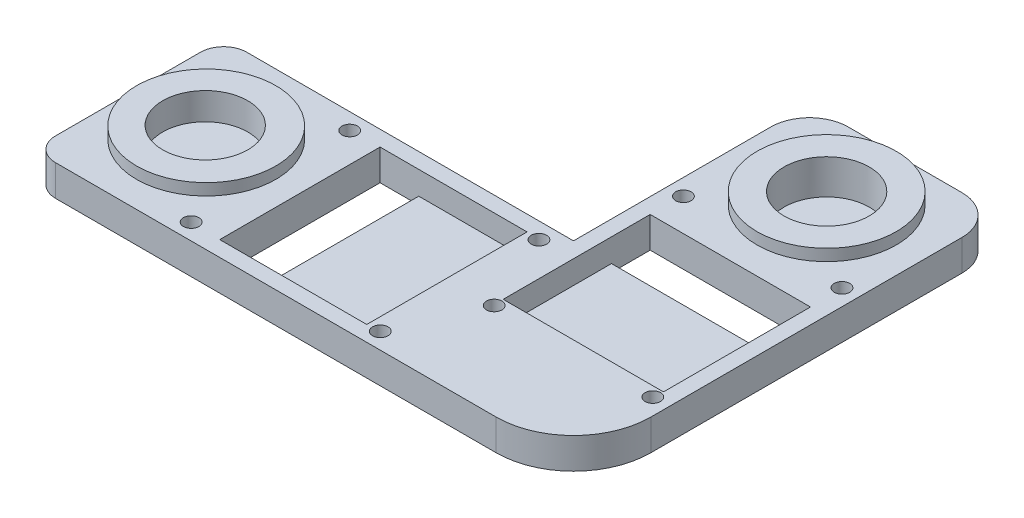
from build123d import *

# Parameters (mm, degrees)
EXTRUDE_1_DEPTH          = 4
CUT_EXTRUDE_1_DEPTH      = 38.905694823
CUT_EXTRUDE_1_DEPTH_BACK = 38.905694823
SKETCH_2_R               = 1
SKETCH_3_W               = 14
SKETCH_3_H               = 20.72
CUT_EXTRUDE_3_DEPTH      = 3
SKETCH_5_W               = 5
SKETCH_5_H               = 20.72
CUT_EXTRUDE_4_DEPTH      = 4
SKETCH_6_R               = 9
EXTRUDE_2_DEPTH          = 1.5
SKETCH_10_R              = 5.5
CUT_EXTRUDE_6_DEPTH      = 3.5
SKETCH_12_W              = 24.72
SKETCH_12_H              = 4
EXTRUDE_3_DEPTH          = 24.72
SKETCH_14_W              = 24.72
SKETCH_14_H              = 4
EXTRUDE_4_DEPTH          = 30.5
SKETCH_15_R              = 1
SKETCH_15_R_2            = 5.5
CUT_EXTRUDE_7_DEPTH      = 4
EXTRUDE_START            = 1.5
SKETCH_16_R              = 9
SKETCH_16_R_2            = 5.5
EXTRUDE_5_DEPTH          = 1.5
SKETCH_17_W              = 20.72
SKETCH_17_H              = 19
CUT_EXTRUDE_8_DEPTH      = 4
SKETCH_19_W              = 20.72
SKETCH_19_H              = 14
EXTRUDE_6_DEPTH          = 1
EXTRUDE_START_2          = -1
SKETCH_20_R              = 5.5
EXTRUDE_7_DEPTH          = 1
FILLET_1_R               = 5
FILLET_2_R               = 5
FILLET_6_R               = 10


with BuildPart() as part:
    # 草图1 → 凸台-拉伸1 (new body)
    with BuildSketch(Plane(origin=(0, 0, 0), x_dir=(1, 0, 0), z_dir=(0, 1, 0))):
        with BuildLine():
            Line((6.61, -12.36), (9.61, -12.36))
            Line((9.61, -12.36), (9.61, -9.36))
            Line((9.61, -9.36), (9.61, 9.36))
            Line((9.61, 9.36), (9.61, 12.36))
            Line((9.61, 12.36), (6.61, 12.36))
            Line((6.61, 12.36), (-32.61, 12.36))
            ThreePointArc((-32.61, 12.36), (-34.731320344, 11.481320344), (-35.61, 9.36))
            Line((-35.61, 9.36), (-35.61, -9.36))
            ThreePointArc((-35.61, -9.36), (-34.731320344, -11.481320344), (-32.61, -12.36))
            Line((-32.61, -12.36), (6.61, -12.36))
        make_face()
    extrude(amount=EXTRUDE_1_DEPTH)

    # 草图2 → 切除-拉伸1 (cut, two sides: drawn at the far end of the back side and taken through both)
    with BuildSketch(Plane(origin=(0, 0, 0), x_dir=(1, 0, 0), z_dir=(0, 1, 0)).offset(-CUT_EXTRUDE_1_DEPTH_BACK)):
        with Locations(Location((7.25, -10.25, 0), (0, 0, 270))):
            Circle(SKETCH_2_R)
        with Locations(Location((7.25, 10.25, 0), (0, 0, 270))):
            Circle(SKETCH_2_R)
        with Locations(Location((-17.2, -10.25, 0), (0, 0, 270))):
            Circle(SKETCH_2_R)
        with Locations(Location((-17.2, 10.25, 0), (0, 0, 270))):
            Circle(SKETCH_2_R)
    extrude(amount=CUT_EXTRUDE_1_DEPTH + CUT_EXTRUDE_1_DEPTH_BACK, mode=Mode.SUBTRACT)

    # 草图3 → 切除-拉伸3 (cut)
    with BuildSketch(Plane(origin=(0, 4, 0), x_dir=(1, 0, 0), z_dir=(0, 1, 0))):
        with Locations((-1.39, 0)):
            Rectangle(SKETCH_3_W, SKETCH_3_H)
    extrude(amount=-CUT_EXTRUDE_3_DEPTH, mode=Mode.SUBTRACT)

    # 草图5 → 切除-拉伸4 (cut)
    with BuildSketch(Plane(origin=(0, 4, 0), x_dir=(1, 0, 0), z_dir=(0, 1, 0))):
        with Locations((-10.89, 0)):
            Rectangle(SKETCH_5_W, SKETCH_5_H)
    extrude(amount=-CUT_EXTRUDE_4_DEPTH, mode=Mode.SUBTRACT)

    # 草图6 → 凸台-拉伸2 (add)
    with BuildSketch(Plane(origin=(0, 4, 0), x_dir=(1, 0, 0), z_dir=(0, 1, 0))):
        with Locations(Location((-25.5, 0, 0), (0, 0, 270))):
            Circle(SKETCH_6_R)
    extrude(amount=EXTRUDE_2_DEPTH)

    # 草图10 → 切除-拉伸6 (cut)
    with BuildSketch(Plane(origin=(0, 5.5, 0), x_dir=(1, 0, 0), z_dir=(0, 1, 0))):
        with Locations(Location((-25.62236192, 0, 0), (0, 0, 270))):
            Circle(SKETCH_10_R)
    extrude(amount=-CUT_EXTRUDE_6_DEPTH, mode=Mode.SUBTRACT)

    # 草图12 → 凸台-拉伸3 (add)
    with BuildSketch(Plane(origin=(9.61, 0, 0), x_dir=(0, 0, -1), z_dir=(1, 0, 0))):
        with Locations((0, 2)):
            Rectangle(SKETCH_12_W, SKETCH_12_H)
    extrude(amount=EXTRUDE_3_DEPTH)

    # 草图14 → 凸台-拉伸4 (add)
    with BuildSketch(Plane(origin=(0, 0, -12.36), x_dir=(-1, 0, 0), z_dir=(0, 0, -1))):
        with Locations((-21.97, 2)):
            Rectangle(SKETCH_14_W, SKETCH_14_H)
    extrude(amount=EXTRUDE_4_DEPTH)

    # 草图15 → 切除-拉伸7 (cut)
    with BuildSketch(Plane(origin=(0, 4, 0), x_dir=(1, 0, 0), z_dir=(0, 1, 0))):
        with Locations(Location((11.72, 24.45, 0), (0, 0, 270))):
            Circle(SKETCH_15_R)
        with Locations(Location((32.22, 24.45, 0), (0, 0, 270))):
            Circle(SKETCH_15_R)
        with Locations(Location((11.72, 0, 0), (0, 0, 270))):
            Circle(SKETCH_15_R)
        with Locations(Location((32.22, 0, 0), (0, 0, 270))):
            Circle(SKETCH_15_R)
        with Locations(Location((21.938853273, 32.75, 0), (0, 0, 270))):
            Circle(SKETCH_15_R_2)
    extrude(amount=-CUT_EXTRUDE_7_DEPTH, mode=Mode.SUBTRACT)

    # 草图16 → 凸台-拉伸5 (add)
    with BuildSketch(Plane(origin=(0, 4, 0), x_dir=(1, 0, 0), z_dir=(0, 1, 0)).offset(EXTRUDE_START)):
        with Locations(Location((21.938853273, 32.75, 0), (0, 0, 270))):
            Circle(SKETCH_16_R)
        with Locations(Location((21.938853273, 32.75, 0), (0, 0, 270))):
            Circle(SKETCH_16_R_2, mode=Mode.SUBTRACT)
    extrude(amount=-EXTRUDE_5_DEPTH)

    # 草图17 → 切除-拉伸8 (cut)
    with BuildSketch(Plane(origin=(0, 4, 0), x_dir=(1, 0, 0), z_dir=(0, 1, 0))):
        with Locations((21.97, 10.77)):
            Rectangle(SKETCH_17_W, SKETCH_17_H)
    extrude(amount=-CUT_EXTRUDE_8_DEPTH, mode=Mode.SUBTRACT)

    # 草图19 → 凸台-拉伸6 (add)
    with BuildSketch(Plane.XZ):
        with Locations((21.97, -8.27)):
            Rectangle(SKETCH_19_W, SKETCH_19_H)
    extrude(amount=-EXTRUDE_6_DEPTH)

    # 草图20 → 凸台-拉伸7 (add)
    with BuildSketch(Plane.XZ.offset(EXTRUDE_START_2)):
        with Locations(Location((21.938853273, -32.75, 0), (0, 0, 90))):
            Circle(SKETCH_20_R)
    extrude(amount=EXTRUDE_7_DEPTH)

    # 圆角1
    fillet_1_edges = [part.edges().sort_by_distance(p)[0] for p in [
        (34.33, 2, -42.86),
    ]]
    fillet(fillet_1_edges, radius=FILLET_1_R)

    # 圆角2
    fillet_2_edges = [part.edges().sort_by_distance(p)[0] for p in [
        (9.61, 2, -42.86),
    ]]
    fillet(fillet_2_edges, radius=FILLET_2_R)

    # 圆角6
    fillet_6_edges = [part.edges().sort_by_distance(p)[0] for p in [
        (34.33, 2, 12.36),
    ]]
    fillet(fillet_6_edges, radius=FILLET_6_R)


solid = part.part
